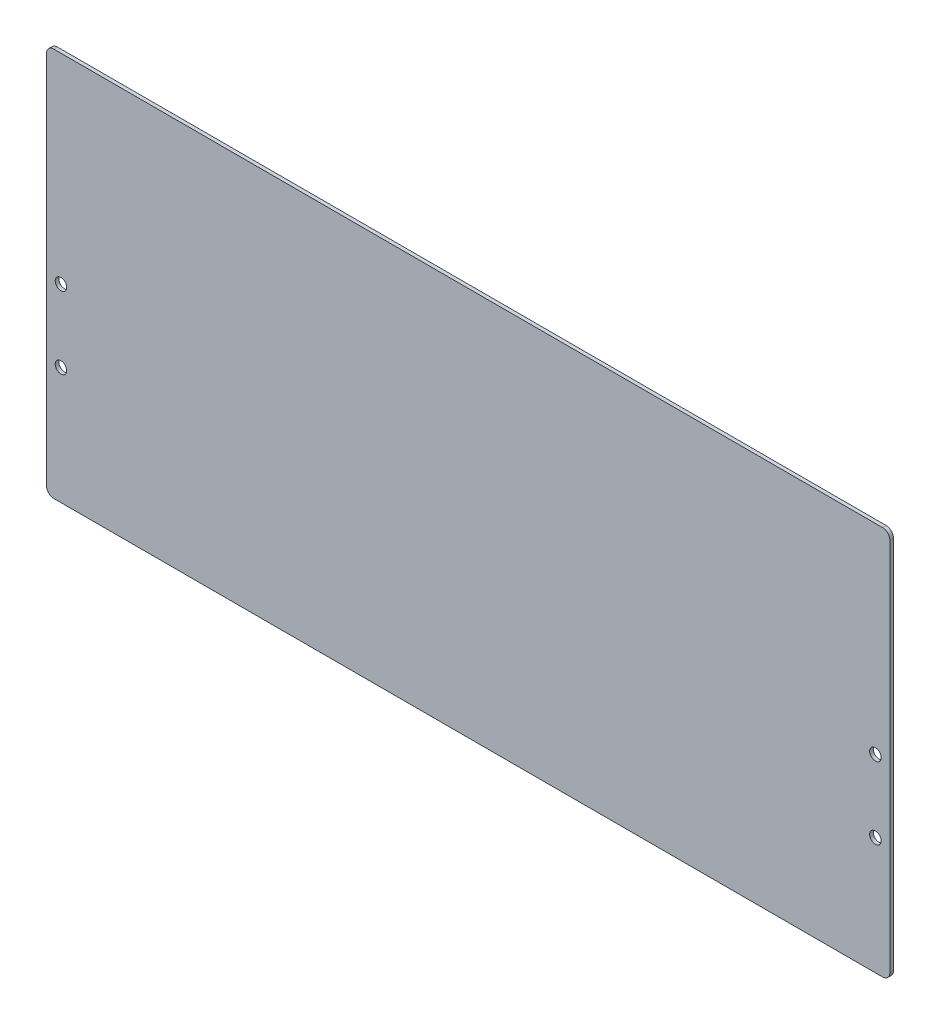
from build123d import *

# Parameters (mm, degrees)
SKETCH_1_W      = 234
SKETCH_1_H      = 108
SKETCH_1_R      = 1.6
EXTRUDE_1_DEPTH = 1
FILLET_1_R      = 2


with BuildPart() as part:
    # 草图1 → 凸台-拉伸1 (new body)
    with BuildSketch(Plane.XY):
        Rectangle(SKETCH_1_W, SKETCH_1_H)
        with Locations((-113, -1.5)):
            Circle(SKETCH_1_R, mode=Mode.SUBTRACT)
        with Locations((-113, -21.5)):
            Circle(SKETCH_1_R, mode=Mode.SUBTRACT)
        with Locations(Location((113, -21.5, 0), (0, 0, 180))):
            Circle(SKETCH_1_R, mode=Mode.SUBTRACT)
        with Locations(Location((113, -1.5, 0), (0, 0, 180))):
            Circle(SKETCH_1_R, mode=Mode.SUBTRACT)
    extrude(amount=EXTRUDE_1_DEPTH)

    # 圆角1
    fillet_1_edges = [part.edges().sort_by_distance(p)[0] for p in [
        (117, -54, 0.5),
        (-117, -54, 0.5),
        (-117, 54, 0.5),
        (117, 54, 0.5),
    ]]
    fillet(fillet_1_edges, radius=FILLET_1_R)


solid = part.part
